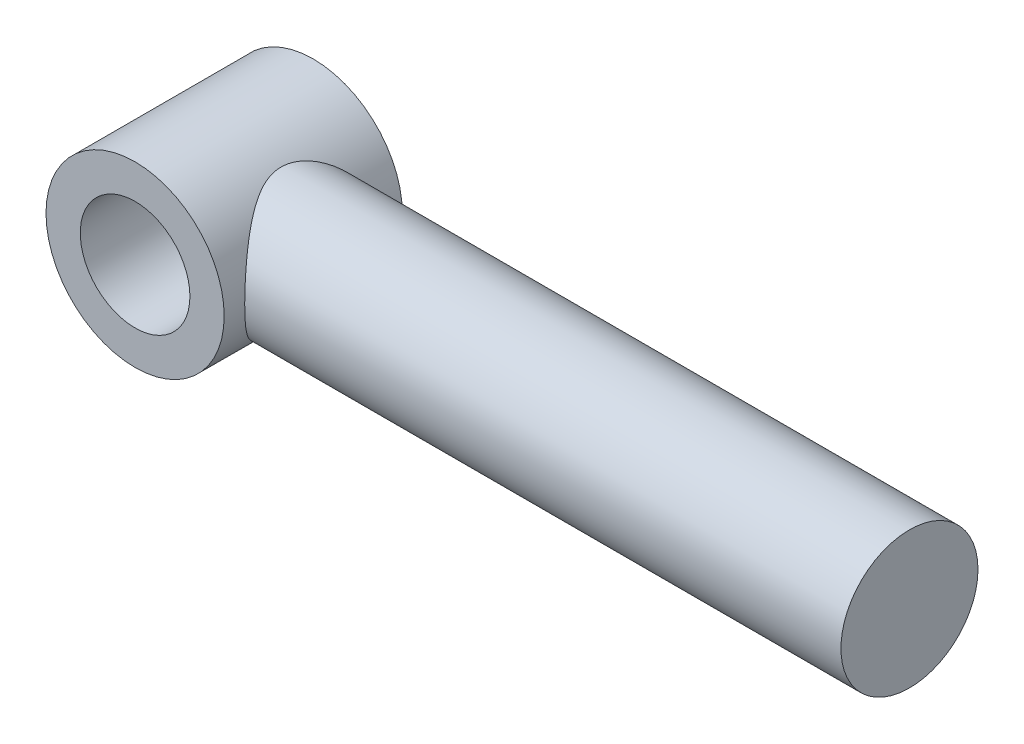
from build123d import *

# Parameters (mm, degrees)
SKETCH_1_R           = 32.5
SKETCH_1_R_2         = 20
EXTRUDE_1_DEPTH      = 32.5
EXTRUDE_2_REACH      = 288.215
EXTRUDE_2_END_RADIUS = 32.5
SKETCH_2_R           = 25


with BuildPart() as part:
    # 草图1 → 凸台-拉伸1 (new, symmetric)
    with BuildSketch(Plane.XY):
        Circle(SKETCH_1_R)
        Circle(SKETCH_1_R_2, mode=Mode.SUBTRACT)
    extrude(amount=EXTRUDE_1_DEPTH, both=True)

    # 凸台-拉伸2: up to this cylinder (the profile starts outside it)
    extrude_2_end = Plane(origin=(0, 0, 0), z_dir=(0, 0, -1)) * Cylinder(EXTRUDE_2_END_RADIUS, 642.43, mode=Mode.PRIVATE)
    # 草图2 → 凸台-拉伸2 (add, up to the surface)
    with BuildSketch(Plane(origin=(250, 0, 0), x_dir=(0, 0, -1), z_dir=(1, 0, 0)), mode=Mode.PRIVATE) as extrude_2_sk1:
        Circle(SKETCH_2_R)
    extrude_2_tool1 = extrude(extrude_2_sk1.sketch, amount=-EXTRUDE_2_REACH, mode=Mode.PRIVATE) - extrude_2_end
    add(extrude_2_tool1.solids().sort_by_distance((250, 0, 0))[0])


solid = part.part
